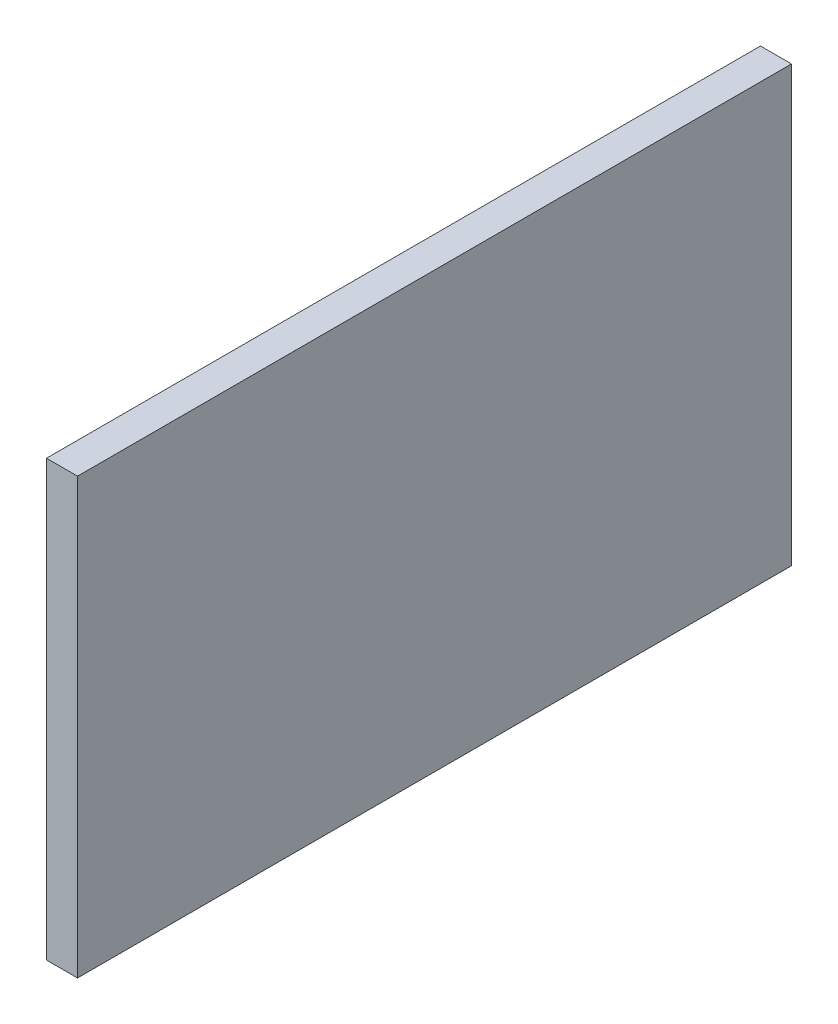
from build123d import *

# Parameters (mm, degrees)
SKETCH1_W           = 69
SKETCH1_H           = 42
BOSS_EXTRUDE1_DEPTH = 3


with BuildPart() as part:
    # Sketch1 → Boss-Extrude1 (new body)
    with BuildSketch(Plane(origin=(0, 0, 0), x_dir=(0, 0, -1), z_dir=(1, 0, 0))):
        Rectangle(SKETCH1_W, SKETCH1_H)
    extrude(amount=BOSS_EXTRUDE1_DEPTH)


solid = part.part
